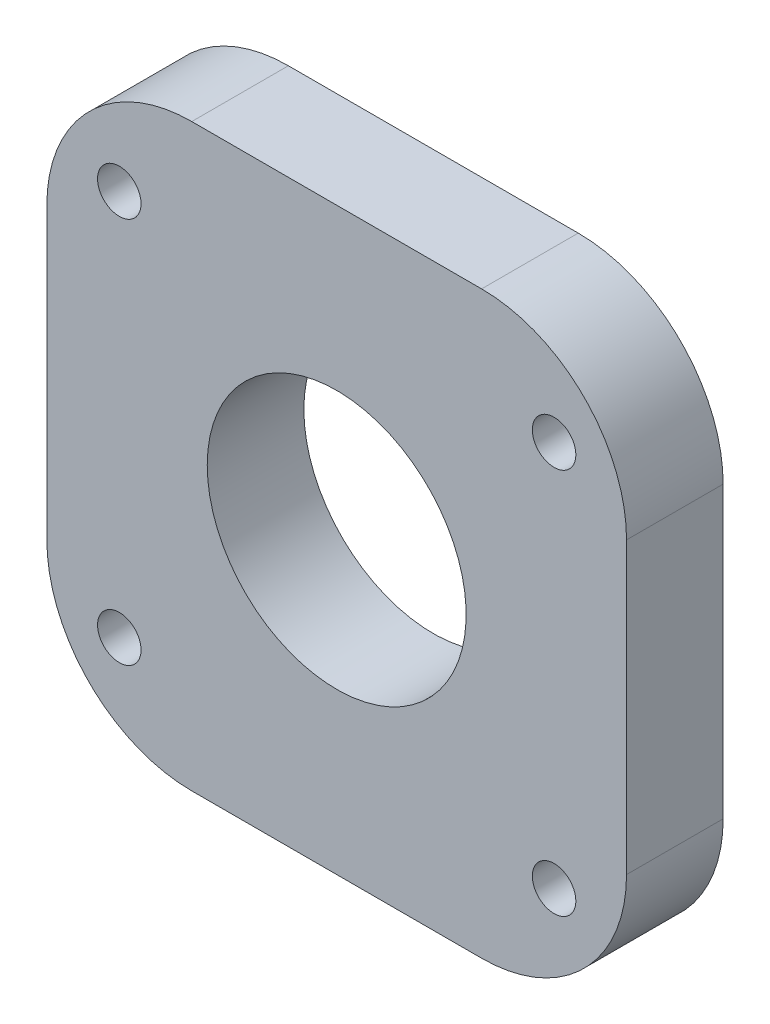
from build123d import *

# Parameters (mm, degrees)
ESQUISSE1_W                         = 60
ESQUISSE1_H                         = 60
BOSS_EXTRU_1_DEPTH                  = 10
DIAM_TRE_DU_PER_AGE_4_5_4_5_1_D     = 4.5
DIAM_TRE_DU_PER_AGE_5_1_5_1_1_D     = 5.1
DIAM_TRE_DU_PER_AGE_5_1_5_1_1_DEPTH = 7
DIAM_TRE_DU_PER_AGE_5_1_5_1_1_TIP   = 1.532194579
ESQUISSE9_R                         = 13.4
ENL_V_MAT_EXTRU_2_DEPTH             = 44.588989435
CONG_3_R                            = 15


with BuildPart() as part:
    # Esquisse1 → Boss.-Extru.1 (new body)
    with BuildSketch(Plane(origin=(0, 0, 0), x_dir=(-1, 0, 0), z_dir=(0, 0, -1))):
        Rectangle(ESQUISSE1_W, ESQUISSE1_H)
    extrude(amount=-BOSS_EXTRU_1_DEPTH)

    # Diamètre du perçage Ø4.5 (4.5)1 (through all)
    with Locations(Plane(origin=(0, 0, 0), x_dir=(-1, 0, 0), z_dir=(0, 0, -1))):
        with Locations((22.5, 20), (-22.5, 20), (-22.5, -20), (22.5, -20)):
            Hole(DIAM_TRE_DU_PER_AGE_4_5_4_5_1_D / 2)

    # Diamètre du perçage Ø5.1 (5.1)1
    with Locations(Plane(origin=(0, 0, 0), x_dir=(-1, 0, 0), z_dir=(0, 0, -1))):
        with Locations((-14.03387511, 11.191641943), (-7.788213117, 16.172391179), (0, 17.95), (7.788213117, 16.172391179), (14.03387511, 11.191641943), (17.499956024, 3.994250765), (17.499956024, -3.994250765), (14.03387511, -11.191641943), (7.788213117, -16.172391179), (0, -17.95), (-7.788213117, -16.172391179), (-14.03387511, -11.191641943), (-17.499956024, -3.994250765), (-17.499956024, 3.994250765)):
            Hole(DIAM_TRE_DU_PER_AGE_5_1_5_1_1_D / 2, depth=DIAM_TRE_DU_PER_AGE_5_1_5_1_1_DEPTH)
            with Locations((0, 0, -(DIAM_TRE_DU_PER_AGE_5_1_5_1_1_DEPTH + DIAM_TRE_DU_PER_AGE_5_1_5_1_1_TIP / 2))):  # 118° drill point
                Cone(0, DIAM_TRE_DU_PER_AGE_5_1_5_1_1_D / 2, DIAM_TRE_DU_PER_AGE_5_1_5_1_1_TIP, mode=Mode.SUBTRACT)

    # Esquisse9 → Enlèv. mat.-Extru.2 (cut, through all)
    with BuildSketch(Plane(origin=(0, 0, 0), x_dir=(-1, 0, 0), z_dir=(0, 0, -1))):
        Circle(ESQUISSE9_R)
    extrude(amount=-ENL_V_MAT_EXTRU_2_DEPTH, mode=Mode.SUBTRACT)

    # Congé3
    cong_3_edges = [part.edges().sort_by_distance(p)[0] for p in [
        (30, 30, 5),
        (-30, 30, 5),
        (-30, -30, 5),
        (30, -30, 5),
    ]]
    fillet(cong_3_edges, radius=CONG_3_R)


solid = part.part
